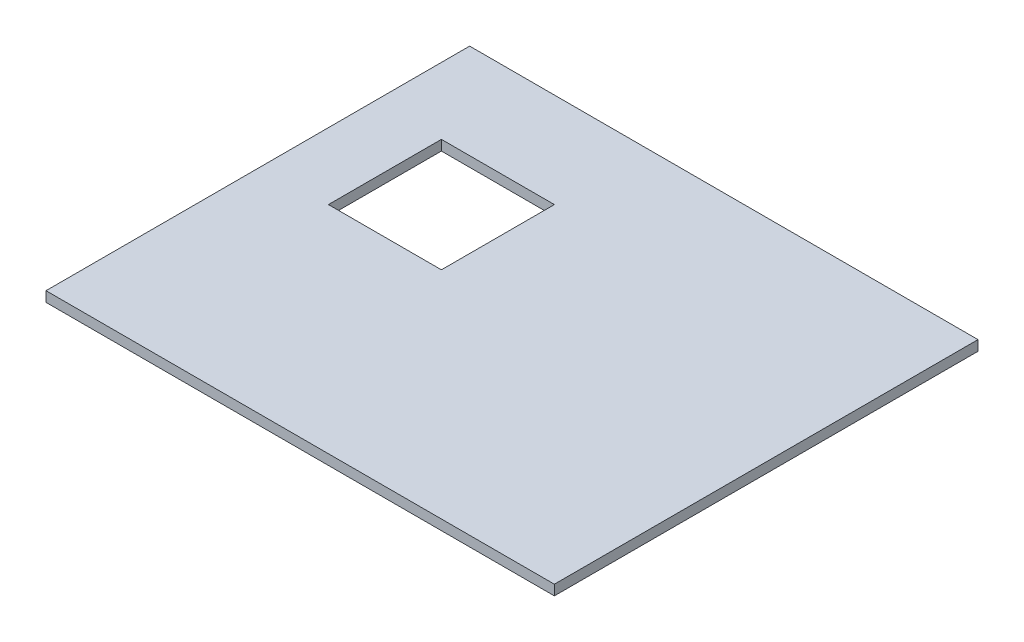
from build123d import *

# Parameters (mm, degrees)
SKETCH1_W           = 914.4
SKETCH1_H           = 762
SKETCH1_W_2         = 203.2
SKETCH1_H_2         = 203.2
BOSS_EXTRUDE1_DEPTH = 18.25625


with BuildPart() as part:
    # Sketch1 → Boss-Extrude1 (new body)
    with BuildSketch(Plane(origin=(0, 0, 0), x_dir=(1, 0, 0), z_dir=(0, 1, 0))):
        Rectangle(SKETCH1_W, SKETCH1_H)
        with Locations((-235.712, 108.74375)):
            Rectangle(SKETCH1_W_2, SKETCH1_H_2, mode=Mode.SUBTRACT)
    extrude(amount=BOSS_EXTRUDE1_DEPTH)


solid = part.part
